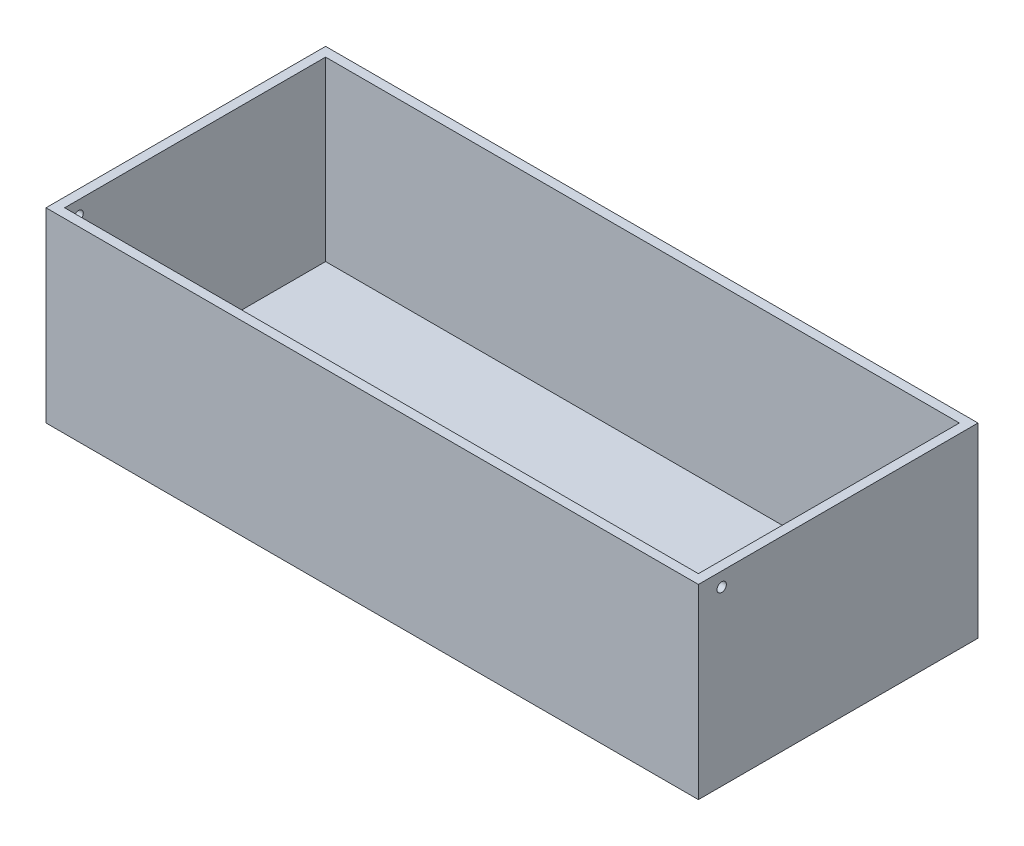
from build123d import *

# Parameters (mm, degrees)
CROQUIS1_W              = 700
CROQUIS1_H              = 300
SALIENTE_EXTRUIR1_DEPTH = 200
CROQUIS2_W              = 680
CROQUIS2_H              = 280
CORTAR_EXTRUIR1_DEPTH   = 190
CROQUIS3_R              = 5
CORTAR_EXTRUIR2_DEPTH   = 700


with BuildPart() as part:
    # Croquis1 → Saliente-Extruir1 (new body)
    with BuildSketch(Plane(origin=(0, 0, 0), x_dir=(1, 0, 0), z_dir=(0, 1, 0))):
        Rectangle(CROQUIS1_W, CROQUIS1_H)
    extrude(amount=SALIENTE_EXTRUIR1_DEPTH)

    # Croquis2 → Cortar-Extruir1 (cut)
    with BuildSketch(Plane(origin=(0, 200, 0), x_dir=(1, 0, 0), z_dir=(0, 1, 0))):
        Rectangle(CROQUIS2_W, CROQUIS2_H)
    extrude(amount=-CORTAR_EXTRUIR1_DEPTH, mode=Mode.SUBTRACT)

    # Croquis3 → Cortar-Extruir2 (cut)
    with BuildSketch(Plane(origin=(350, 0, 0), x_dir=(0, 0, -1), z_dir=(1, 0, 0))):
        with Locations((-125, 185)):
            Circle(CROQUIS3_R)
    extrude(amount=-CORTAR_EXTRUIR2_DEPTH, mode=Mode.SUBTRACT)


solid = part.part
